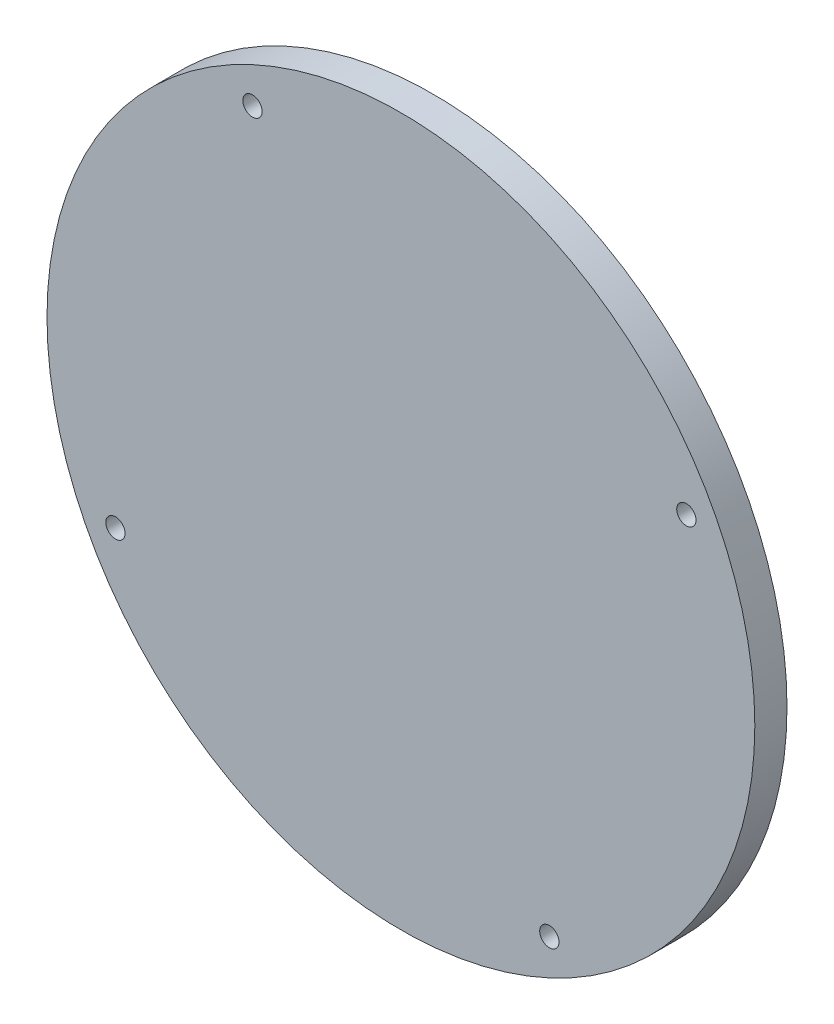
from build123d import *

# Parameters (mm, degrees)
ESQUISSE1_R             = 55
BOSS_EXTRU_1_DEPTH      = 5
ESQUISSE2_R             = 1.5
ENL_V_MAT_EXTRU_1_DEPTH = 78.942286341


with BuildPart() as part:
    # Esquisse1 → Boss.-Extru.1 (new body)
    with BuildSketch(Plane.XY):
        Circle(ESQUISSE1_R)
    extrude(amount=BOSS_EXTRU_1_DEPTH)

    # Esquisse2 → Enlèv. mat.-Extru.1 (cut, through all)
    with BuildSketch(Plane.XY.offset(5)):
        with Locations((23.068227683, -44.360532814)):
            Circle(ESQUISSE2_R)
        with Locations((-44.360532814, -23.068227683)):
            Circle(ESQUISSE2_R)
        with Locations((-23.068227683, 44.360532814)):
            Circle(ESQUISSE2_R)
        with Locations((44.360532814, 23.068227683)):
            Circle(ESQUISSE2_R)
    extrude(amount=-ENL_V_MAT_EXTRU_1_DEPTH, mode=Mode.SUBTRACT)


solid = part.part
